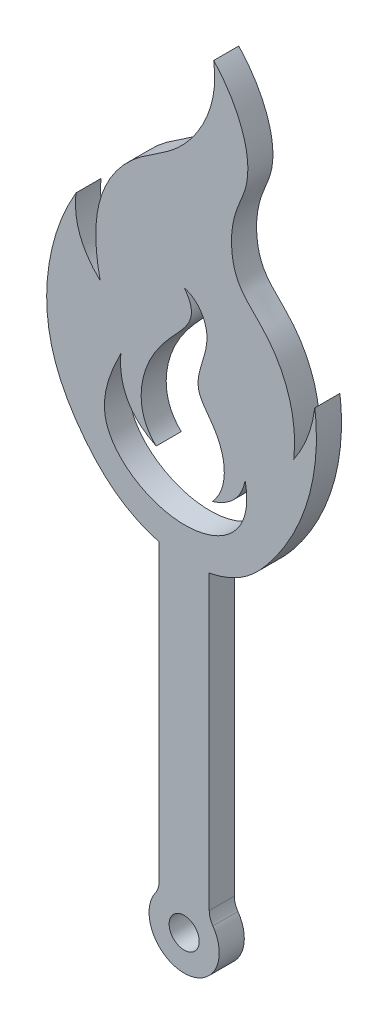
from build123d import *

# Parameters (mm, degrees)
SKETCH_1_R      = 1.5
EXTRUDE_1_DEPTH = 2.5
EXTRUDE_2_DEPTH = 2.5


with BuildPart() as part:
    # 草图1 → 凸台-拉伸1 (new body)
    with BuildSketch(Plane.XY):
        with BuildLine():
            Line((-2.5, 3.16227766), (-2.5, 33.16227766))
            Line((-2.5, 33.16227766), (2.5, 33.16227766))
            Line((2.5, 33.16227766), (2.5, 3.16227766))
            ThreePointArc((2.5, 3.16227766), (2.593074822, 2.559254971), (2.863636364, 2.012358511))
            ThreePointArc((2.863636364, 2.012358511), (0, -3.5), (-2.863636364, 2.012358511))
            ThreePointArc((-2.863636364, 2.012358511), (-2.593074822, 2.559254971), (-2.5, 3.16227766))
        make_face()
        Circle(SKETCH_1_R, mode=Mode.SUBTRACT)
    extrude(amount=EXTRUDE_1_DEPTH)

    # 草图3 → 凸台-拉伸2 (add)
    with BuildSketch(Plane.XY):
        with BuildLine():
            add(Edge.make_bspline(
                [(13.030008627, 51.844332221), (13.74379778, 46.20303282), (11.603311076, 39.411743555), (5.694539009, 33.026560377), (0.06310906, 31.476510815), (-5.938123223, 33.386001235), (-10.437145597, 37.95176441), (-15.075154039, 45.990158866), (-13.333751605, 54.20267923), (-10.782884431, 58.505555606)],
                knots=[0, 0, 0, 0, 0.274188336, 0.336809371, 0.426488787, 0.549059577, 0.630888515, 0.743399692, 1, 1, 1, 1], degree=3))
            add(Edge.make_bspline(
                [(-10.782884431, 58.505555606), (-11.216241735, 54.813303601), (-8.366423312, 52.116268581)],
                knots=[0, 0, 0, 1, 1, 1], degree=2))
            add(Edge.make_bspline(
                [(-8.366423312, 52.116268581), (-8.926561192, 54.567170602), (-9.14623331, 59.356108625), (-5.375140908, 64.531118053), (-0.993155908, 66.778771451), (2.387830751, 70.859843716), (3.310682538, 74.537905882), (2.941368858, 76.801367622)],
                knots=[0, 0, 0, 0, 0.264249972, 0.465969617, 0.622952578, 0.768650593, 1, 1, 1, 1], degree=3))
            add(Edge.make_bspline(
                [(2.941368858, 76.801367622), (5.164622483, 74.500255208), (7.468684604, 69.664705034), (4.880128248, 64.613471092), (4.512079656, 61.628617008), (5.422711445, 58.201828704), (9.902080446, 54.717761781), (11.341860507, 49.784976586), (10.927237278, 46.342799268)],
                knots=[0, 0, 0, 0, 0.308930758, 0.378034041, 0.507503817, 0.572041872, 0.689799893, 1, 1, 1, 1], degree=3))
            add(Edge.make_bspline(
                [(10.927237278, 46.342799268), (12.642600648, 48.842046286), (13.030008627, 51.844332221)],
                knots=[0, 0, 0, 1, 1, 1], degree=2))
        make_face()
        with BuildLine():
            add(Edge.make_bspline(
                [(-6.314607616, 46.874525086), (-7.185471605, 45.132998982), (-9.578363226, 39.771279985), (-0.639228761, 32.989686689), (7.184073348, 36.77945643), (6.081863089, 42.080759749)],
                knots=[0, 0, 0, 0, 0.245235377, 0.543680646, 1, 1, 1, 1], degree=3))
            add(Edge.make_bspline(
                [(6.081863089, 42.080759749), (5.565285886, 39.516371923), (2.816862005, 38.650282124)],
                knots=[0, 0, 0, 1, 1, 1], degree=2))
            add(Edge.make_bspline(
                [(2.816862005, 38.650282124), (4.457350443, 40.466562823), (4.195927725, 44.139134684), (0.370759673, 48.008484784), (3.285831901, 52.265139808), (1.414003937, 55.320210325), (0.000188371, 55.70189907)],
                knots=[0, 0, 0, 0, 0.356718219, 0.515081121, 0.783237716, 1, 1, 1, 1], degree=3))
            add(Edge.make_bspline(
                [(0.000188371, 55.70189907), (1.637930063, 53.699479573), (-1.080507308, 51.254114838), (-4.437935186, 46.855363752), (-4.719085804, 42.428895259), (-2.787135359, 40.636763739)],
                knots=[0, 0, 0, 0, 0.313581213, 0.580495324, 1, 1, 1, 1], degree=3))
            add(Edge.make_bspline(
                [(-6.314607616, 46.874525086), (-6.671577447, 42.504428303), (-2.787135359, 40.636763739)],
                knots=[0, 0, 0, 1, 1, 1], degree=2))
        make_face(mode=Mode.SUBTRACT)
    extrude(amount=EXTRUDE_2_DEPTH)


solid = part.part
